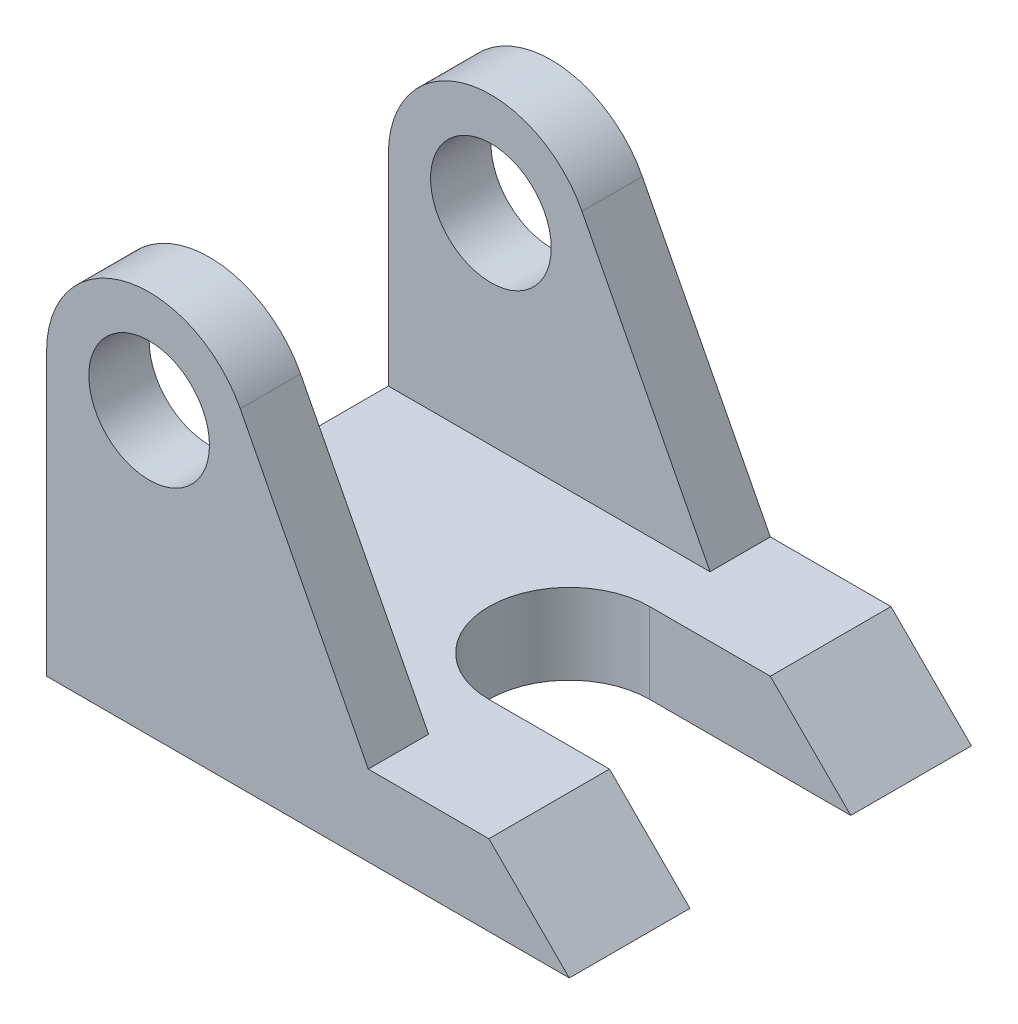
from build123d import *

# Parameters (mm, degrees)
BOSS_EXTRUDE1_DEPTH    = 50
SKETCH2_W              = 171.937170065
SKETCH2_H              = 70
CUT_EXTRUDE1_DEPTH     = 159.430584169
CUT_EXTRUDE2_DEPTH     = 159.430584169
F_20_0MM_DOWEL_HOLE1_D = 30


with BuildPart() as part:
    # Sketch1 → Boss-Extrude1 (new, symmetric)
    with BuildSketch(Plane.XY):
        with BuildLine():
            Line((0, 0), (130, 0))
            Line((130, 0), (110, 20))
            Line((110, 20), (80, 20))
            Line((80, 20), (48.160217592, 81.694637176))
            ThreePointArc((48.160217592, 81.694637176), (19.482755972, 94.779886487), (0, 70))
            Line((0, 70), (0, 0))
        make_face()
    extrude(amount=BOSS_EXTRUDE1_DEPTH, both=True)

    # Sketch2 → Cut-Extrude1 (cut, through all)
    with BuildSketch(Plane(origin=(0, 20, 0), x_dir=(1, 0, 0), z_dir=(0, 1, 0))):
        with Locations((69.738425947, 0)):
            Rectangle(SKETCH2_W, SKETCH2_H)
    extrude(amount=CUT_EXTRUDE1_DEPTH, mode=Mode.SUBTRACT)

    # Sketch3 → Cut-Extrude2 (cut, through all)
    with BuildSketch(Plane(origin=(0, 20, 0), x_dir=(1, 0, 0), z_dir=(0, 1, 0))):
        with BuildLine():
            Line((80, 20), (153.648677571, 20))
            Line((153.648677571, 20), (153.648677571, -20))
            Line((153.648677571, -20), (80, -20))
            ThreePointArc((80, -20), (60, 0), (80, 20))
        make_face()
    extrude(amount=-CUT_EXTRUDE2_DEPTH, mode=Mode.SUBTRACT)

    # Ø20.0mm Dowel Hole1 (through all)
    with Locations(Plane.XY.offset(50)):
        with Locations((25.5, 70)):
            Hole(F_20_0MM_DOWEL_HOLE1_D / 2)


solid = part.part
